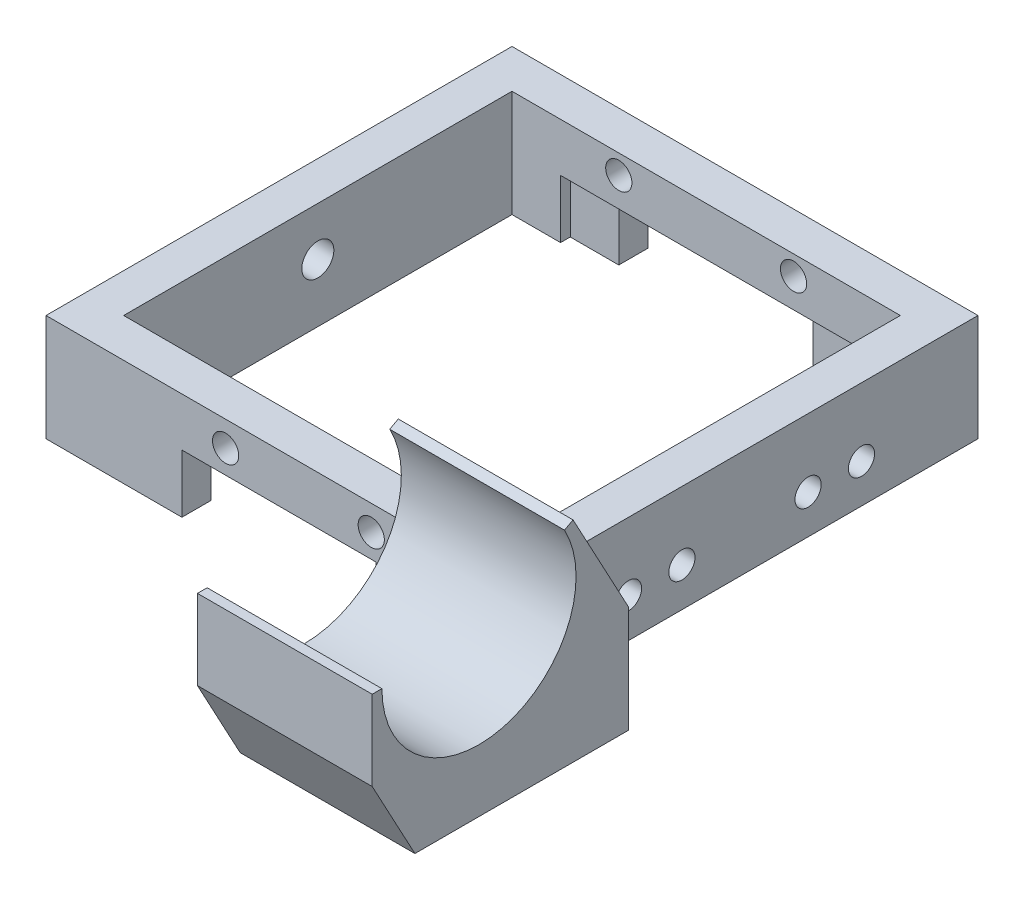
from build123d import *

# Parameters (mm, degrees)
SKETCH1_W                = 48
SKETCH1_H                = 48
SKETCH1_W_2              = 40
SKETCH1_H_2              = 40
BOSS_EXTRUDE1_DEPTH      = 11
SKETCH3_W                = 20
SKETCH3_H                = 6
CUT_EXTRUDE1_DEPTH       = 55.781383699
SKETCH4_W                = 5
SKETCH4_H                = 6
CUT_EXTRUDE2_DEPTH       = 1
SKETCH5_W                = 5
SKETCH5_H                = 6
CUT_EXTRUDE3_DEPTH       = 1
CUT_EXTRUDE4_REACH       = 56.781
SKETCH6_R                = 1.35
CUT_EXTRUDE5_REACH       = 56.781
SKETCH7_R                = 1.35
CUT_EXTRUDE6_REACH       = 56.781
SKETCH8_R                = 1.35
CUT_EXTRUDE7_REACH       = 56.781
SKETCH9_R                = 1.65
BOSS_EXTRUDE7_DEPTH      = 8
BOSS_EXTRUDE7_DEPTH_BACK = 10


with BuildPart() as part:
    # Sketch1 → Boss-Extrude1 (new body)
    with BuildSketch(Plane(origin=(0, 0, 0), x_dir=(1, 0, 0), z_dir=(0, 1, 0))):
        Rectangle(SKETCH1_W, SKETCH1_H)
        Rectangle(SKETCH1_W_2, SKETCH1_H_2, mode=Mode.SUBTRACT)
    extrude(amount=BOSS_EXTRUDE1_DEPTH)

    # Sketch3 → Cut-Extrude1 (cut, through all)
    with BuildSketch(Plane.XY.offset(24)):
        with Locations((0, 3)):
            Rectangle(SKETCH3_W, SKETCH3_H)
    extrude(amount=-CUT_EXTRUDE1_DEPTH, mode=Mode.SUBTRACT)

    # Sketch4 → Cut-Extrude2 (cut)
    with BuildSketch(Plane.XY.offset(-20)):
        with Locations((-12.5, 3)):
            Rectangle(SKETCH4_W, SKETCH4_H)
        with Locations((12.5, 3)):
            Rectangle(SKETCH4_W, SKETCH4_H)
    extrude(amount=-CUT_EXTRUDE2_DEPTH, mode=Mode.SUBTRACT)

    # Sketch5 → Cut-Extrude3 (cut)
    with BuildSketch(Plane(origin=(0, 0, 20), x_dir=(-1, 0, 0), z_dir=(0, 0, -1))):
        with Locations((-12.5, 3)):
            Rectangle(SKETCH5_W, SKETCH5_H)
        with Locations((12.5, 3)):
            Rectangle(SKETCH5_W, SKETCH5_H)
    extrude(amount=-CUT_EXTRUDE3_DEPTH, mode=Mode.SUBTRACT)

    # Sketch6 → Cut-Extrude4 (cut, up to next)
    with BuildSketch(Plane(origin=(0, 0, -24), x_dir=(-1, 0, 0), z_dir=(0, 0, -1)), mode=Mode.PRIVATE) as cut_extrude4_sk1:
        with Locations((-9, 9)):
            Circle(SKETCH6_R)
    cut_extrude4_tool1 = extrude(cut_extrude4_sk1.sketch, amount=-CUT_EXTRUDE4_REACH, mode=Mode.PRIVATE) & part.part
    # Sketch6 → Cut-Extrude4 (cut, up to next)
    with BuildSketch(Plane(origin=(0, 0, -24), x_dir=(-1, 0, 0), z_dir=(0, 0, -1)), mode=Mode.PRIVATE) as cut_extrude4_sk2:
        with Locations((9, 9)):
            Circle(SKETCH6_R)
    cut_extrude4_tool2 = extrude(cut_extrude4_sk2.sketch, amount=-CUT_EXTRUDE4_REACH, mode=Mode.PRIVATE) & part.part
    add(cut_extrude4_tool1.solids().sort_by_distance((9, 9, -24))[0], mode=Mode.SUBTRACT)
    add(cut_extrude4_tool2.solids().sort_by_distance((-9, 9, -24))[0], mode=Mode.SUBTRACT)

    # Sketch7 → Cut-Extrude5 (cut, up to next)
    with BuildSketch(Plane.XY.offset(24), mode=Mode.PRIVATE) as cut_extrude5_sk1:
        with Locations((9.5, 8.412816521)):
            Circle(SKETCH7_R)
    cut_extrude5_tool1 = extrude(cut_extrude5_sk1.sketch, amount=-CUT_EXTRUDE5_REACH, mode=Mode.PRIVATE) & part.part
    # Sketch7 → Cut-Extrude5 (cut, up to next)
    with BuildSketch(Plane.XY.offset(24), mode=Mode.PRIVATE) as cut_extrude5_sk2:
        with Locations((-5.5, 8.412816521)):
            Circle(SKETCH7_R)
    cut_extrude5_tool2 = extrude(cut_extrude5_sk2.sketch, amount=-CUT_EXTRUDE5_REACH, mode=Mode.PRIVATE) & part.part
    add(cut_extrude5_tool1.solids().sort_by_distance((9.5, 8.412817, 24))[0], mode=Mode.SUBTRACT)
    add(cut_extrude5_tool2.solids().sort_by_distance((-5.5, 8.412817, 24))[0], mode=Mode.SUBTRACT)

    # Sketch8 → Cut-Extrude6 (cut, up to next)
    with BuildSketch(Plane(origin=(24, 0, 0), x_dir=(0, 0, -1), z_dir=(1, 0, 0)), mode=Mode.PRIVATE) as cut_extrude6_sk1:
        with Locations((-12, 4)):
            Circle(SKETCH8_R)
    cut_extrude6_tool1 = extrude(cut_extrude6_sk1.sketch, amount=-CUT_EXTRUDE6_REACH, mode=Mode.PRIVATE) & part.part
    # Sketch8 → Cut-Extrude6 (cut, up to next)
    with BuildSketch(Plane(origin=(24, 0, 0), x_dir=(0, 0, -1), z_dir=(1, 0, 0)), mode=Mode.PRIVATE) as cut_extrude6_sk2:
        with Locations((-6.5, 4)):
            Circle(SKETCH8_R)
    cut_extrude6_tool2 = extrude(cut_extrude6_sk2.sketch, amount=-CUT_EXTRUDE6_REACH, mode=Mode.PRIVATE) & part.part
    # Sketch8 → Cut-Extrude6 (cut, up to next)
    with BuildSketch(Plane(origin=(24, 0, 0), x_dir=(0, 0, -1), z_dir=(1, 0, 0)), mode=Mode.PRIVATE) as cut_extrude6_sk3:
        with Locations(Location((6.5, 4, 0), (0, 0, 180))):
            Circle(SKETCH8_R)
    cut_extrude6_tool3 = extrude(cut_extrude6_sk3.sketch, amount=-CUT_EXTRUDE6_REACH, mode=Mode.PRIVATE) & part.part
    # Sketch8 → Cut-Extrude6 (cut, up to next)
    with BuildSketch(Plane(origin=(24, 0, 0), x_dir=(0, 0, -1), z_dir=(1, 0, 0)), mode=Mode.PRIVATE) as cut_extrude6_sk4:
        with Locations(Location((12, 4, 0), (0, 0, 180))):
            Circle(SKETCH8_R)
    cut_extrude6_tool4 = extrude(cut_extrude6_sk4.sketch, amount=-CUT_EXTRUDE6_REACH, mode=Mode.PRIVATE) & part.part
    add(cut_extrude6_tool1.solids().sort_by_distance((24, 4, 12))[0], mode=Mode.SUBTRACT)
    add(cut_extrude6_tool2.solids().sort_by_distance((24, 4, 6.5))[0], mode=Mode.SUBTRACT)
    add(cut_extrude6_tool3.solids().sort_by_distance((24, 4, -6.5))[0], mode=Mode.SUBTRACT)
    add(cut_extrude6_tool4.solids().sort_by_distance((24, 4, -12))[0], mode=Mode.SUBTRACT)

    # Sketch9 → Cut-Extrude7 (cut, up to next)
    with BuildSketch(Plane.ZY.offset(24), mode=Mode.PRIVATE) as cut_extrude7_sk1:
        with Locations((0, 6)):
            Circle(SKETCH9_R)
    cut_extrude7_tool1 = extrude(cut_extrude7_sk1.sketch, amount=-CUT_EXTRUDE7_REACH, mode=Mode.PRIVATE) & part.part
    add(cut_extrude7_tool1.solids().sort_by_distance((-24, 6, 0))[0], mode=Mode.SUBTRACT)

    # Sketch10 → Boss-Extrude7 (add, two sides: drawn at the far end of the back side and taken through both)
    with BuildSketch(Plane(origin=(24, 0, 0), x_dir=(0, 0, -1), z_dir=(1, 0, 0)).offset(-BOSS_EXTRUDE7_DEPTH_BACK)):
        with BuildLine():
            Line((-42, 0), (-20, 0))
            Line((-20, 0), (-20, 11))
            Line((-20, 11), (-25.711810571, 21.622325672))
            ThreePointArc((-25.711810571, 21.622325672), (-32.713932588, 5.745809356), (-46.4, 16.412816521))
            Line((-46.4, 16.412816521), (-46.4, 8.182735119))
            Line((-46.4, 8.182735119), (-42, 0))
        make_face()
        with BuildLine():
            ThreePointArc((-46.4, 16.412816521), (-32.713932588, 5.745809356), (-25.711810571, 21.622325672))
            Line((-25.711810571, 21.622325672), (-26.592555065, 21.148733931))
            ThreePointArc((-26.592555065, 21.148733931), (-32.958120534, 6.71553728), (-45.4, 16.412816521))
            Line((-45.4, 16.412816521), (-46.4, 16.412816521))
        make_face()
    extrude(amount=BOSS_EXTRUDE7_DEPTH + BOSS_EXTRUDE7_DEPTH_BACK)


solid = part.part
